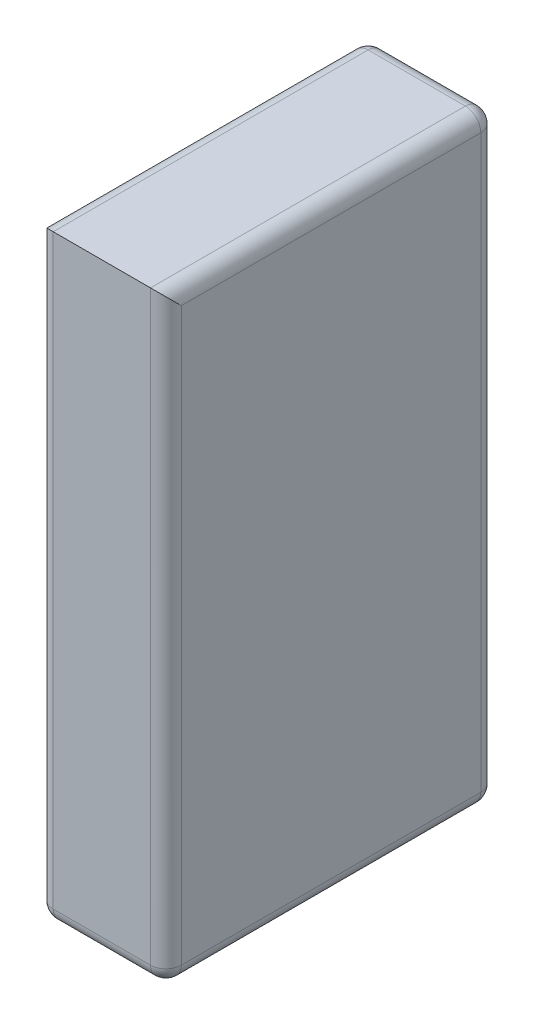
from build123d import *

# Parameters (mm, degrees)
SKETCH1_W           = 78
SKETCH1_H           = 42.8
BOSS_EXTRUDE1_DEPTH = 16.6
FILLET1_R           = 2


with BuildPart() as part:
    # Sketch1 → Boss-Extrude1 (new body)
    with BuildSketch(Plane.YZ):
        with Locations((39, 21.4)):
            Rectangle(SKETCH1_W, SKETCH1_H)
    extrude(amount=BOSS_EXTRUDE1_DEPTH)

    # Fillet1
    fillet1_edges = [part.edges().sort_by_distance(p)[0] for p in [
        (16.6, 78, 21.4),
        (16.6, 39, 42.8),
        (16.6, 0, 21.4),
        (0, 39, 42.8),
        (0, 78, 21.4),
        (0, 39, 0),
        (0, 0, 21.4),
        (8.3, 0, 42.8),
        (8.3, 78, 0),
        (8.3, 0, 0),
        (16.6, 39, 0),
    ]]
    fillet(fillet1_edges, radius=FILLET1_R)


solid = part.part
